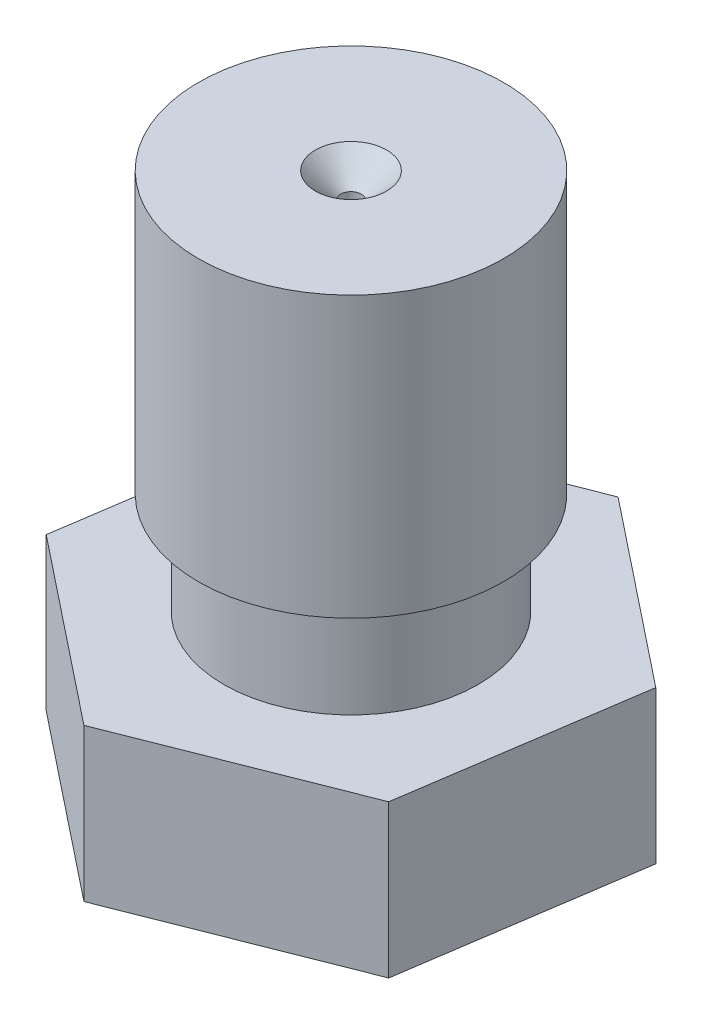
from build123d import *

# Parameters (mm, degrees)
CHAMFER1_SIZE      = 0.5
CUT_EXTRUDE1_DEPTH = 10


with BuildPart() as part:
    # Sketch1 → Revolve1 (revolve)
    with BuildSketch(Plane.XY, mode=Mode.PRIVATE) as revolve1_sk:
        Polygon((0.2, 12.5), (3, 12.5), (3, 7), (2.5, 7), (2.5, 5), (4.695980025, 5), (4.695980025, 2), (2.000415076, 2), (0.6, 0), (0.2, 0), align=None)
    revolve(revolve1_sk.sketch.rotate(Axis((0, 12.5, 0), (0, -1, 0)), 90), axis=Axis((0, 12.5, 0), (0, -1, 0)))

    # Chamfer1
    chamfer1_edges = [part.edges().sort_by_distance(p)[0] for p in [
        (0, 12.5, -0.2),
    ]]
    chamfer(chamfer1_edges, length=CHAMFER1_SIZE)

    # Sketch2 → Cut-Extrude1 (cut)
    with BuildSketch(Plane(origin=(0, 5, 0), x_dir=(1, 0, 0), z_dir=(0, 1, 0))):
        Polygon((11.635778681, -2.533914076), (8.012323301, 8.809922892), (-3.62345538, 11.343836968), (-11.635778681, 2.533914076), (-8.012323301, -8.809922892), (3.62345538, -11.343836968), align=None)
        Polygon((-0.681740496, -4.568212258), (3.615317617, -2.874510717), (4.297058113, 1.693701541), (0.681740496, 4.568212258), (-3.615317617, 2.874510717), (-4.297058113, -1.693701541), align=None, mode=Mode.SUBTRACT)
    extrude(amount=-CUT_EXTRUDE1_DEPTH, mode=Mode.SUBTRACT)


solid = part.part
